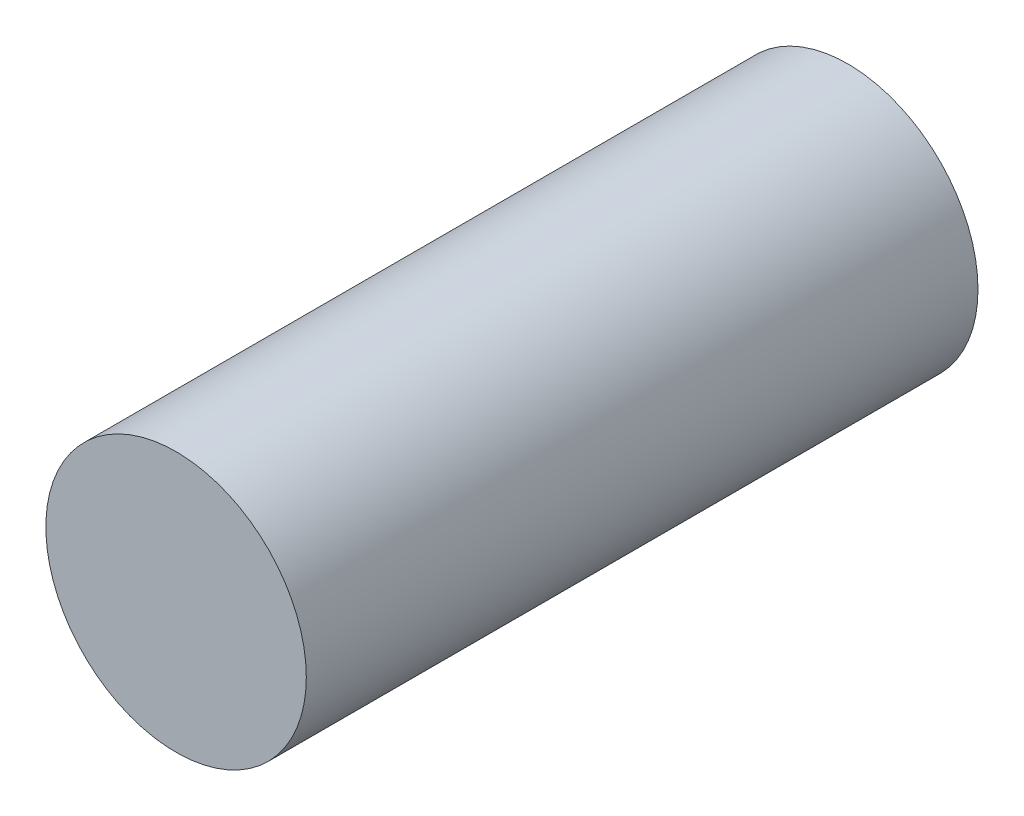
from build123d import *

# Parameters (mm, degrees)
SKETCH1_R           = 19
BOSS_EXTRUDE1_DEPTH = 98


with BuildPart() as part:
    # Sketch1 → Boss-Extrude1 (new body)
    with BuildSketch(Plane.XY):
        Circle(SKETCH1_R)
    extrude(amount=BOSS_EXTRUDE1_DEPTH)


solid = part.part
